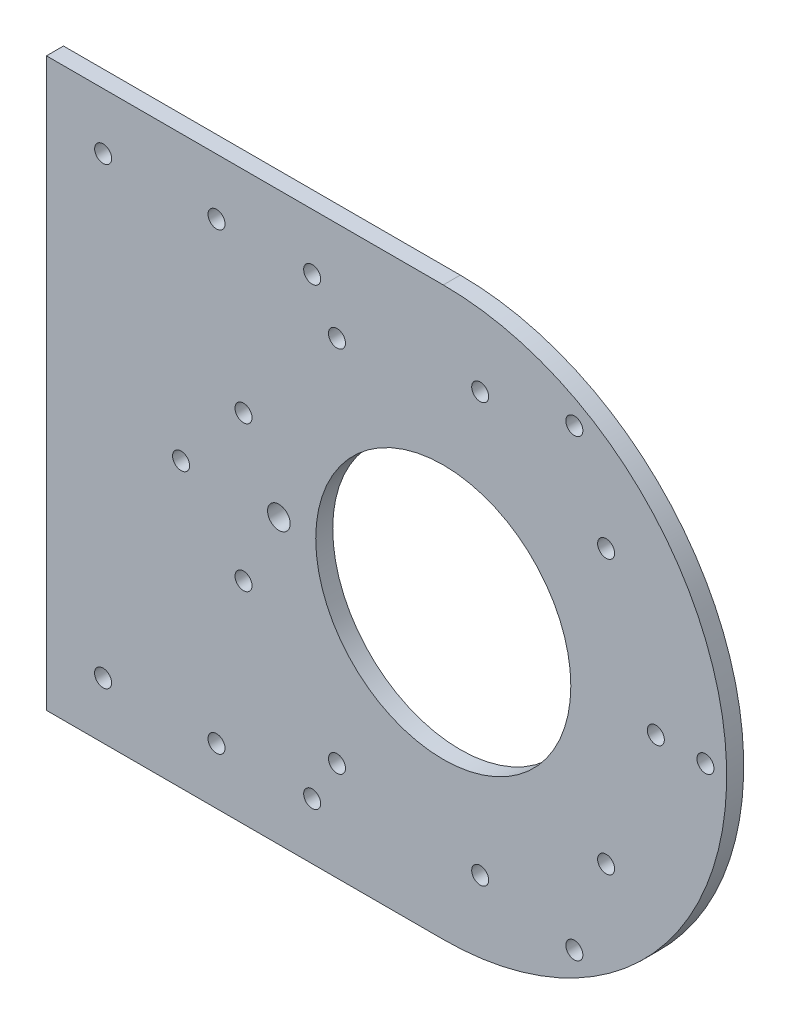
from build123d import *

# Parameters (mm, degrees)
SKETCH_1_R          = 1.5
SKETCH_1_R_2        = 22.5
EXTRUDE_1_DEPTH     = 3
SKETCH_2_R          = 2
SKETCH_2_R_2        = 1.75
CUT_EXTRUDE_1_DEPTH = 10
SKETCH_3_R          = 1.5
SKETCH_3_R_2        = 1.75
SKETCH_3_R_3        = 22.5
CUT_EXTRUDE_2_DEPTH = 10
SKETCH_4_R          = 1.5
CUT_EXTRUDE_3_DEPTH = 10
SKETCH_5_R          = 1.5
CUT_EXTRUDE_4_DEPTH = 95.387499172


with BuildPart() as part:
    # 草图1 → 凸台-拉伸1 (new body)
    with BuildSketch(Plane.XY):
        with BuildLine():
            Line((-10, 50), (-350, 50))
            ThreePointArc((-350, 50), (-400, 0), (-350, -50))
            Line((-350, -50), (-10, -50))
            ThreePointArc((-10, -50), (40, 0), (-10, 50))
        make_face()
        with Locations((-387.5, 0)):
            Circle(SKETCH_1_R, mode=Mode.SUBTRACT)
        with Locations((-378.726666617, 24.104535363)):
            Circle(SKETCH_1_R, mode=Mode.SUBTRACT)
        with Locations((-356.511806663, 36.930290738)):
            Circle(SKETCH_1_R, mode=Mode.SUBTRACT)
        with Locations((-331.25, 32.475952642)):
            Circle(SKETCH_1_R, mode=Mode.SUBTRACT)
        with Locations((-314.761526721, 12.825755375)):
            Circle(SKETCH_1_R, mode=Mode.SUBTRACT)
        with Locations((-314.761526721, -12.825755375)):
            Circle(SKETCH_1_R, mode=Mode.SUBTRACT)
        with Locations((-331.25, -32.475952642)):
            Circle(SKETCH_1_R, mode=Mode.SUBTRACT)
        with Locations((-356.511806663, -36.930290738)):
            Circle(SKETCH_1_R, mode=Mode.SUBTRACT)
        with Locations((-378.726666617, -24.104535363)):
            Circle(SKETCH_1_R, mode=Mode.SUBTRACT)
        with Locations((-350, 0)):
            Circle(SKETCH_1_R_2, mode=Mode.SUBTRACT)
        with Locations((-10, 0)):
            Circle(SKETCH_1_R_2, mode=Mode.SUBTRACT)
        with Locations((18.726666617, -24.104535363)):
            Circle(SKETCH_1_R, mode=Mode.SUBTRACT)
        with Locations((-3.488193337, -36.930290738)):
            Circle(SKETCH_1_R, mode=Mode.SUBTRACT)
        with Locations((-28.75, -32.475952642)):
            Circle(SKETCH_1_R, mode=Mode.SUBTRACT)
        with Locations((-45.238473279, -12.825755375)):
            Circle(SKETCH_1_R, mode=Mode.SUBTRACT)
        with Locations((-45.238473279, 12.825755375)):
            Circle(SKETCH_1_R, mode=Mode.SUBTRACT)
        with Locations((-28.75, 32.475952642)):
            Circle(SKETCH_1_R, mode=Mode.SUBTRACT)
        with Locations((-3.488193337, 36.930290738)):
            Circle(SKETCH_1_R, mode=Mode.SUBTRACT)
        with Locations((18.726666617, 24.104535363)):
            Circle(SKETCH_1_R, mode=Mode.SUBTRACT)
        with Locations((27.5, 0)):
            Circle(SKETCH_1_R, mode=Mode.SUBTRACT)
    extrude(amount=EXTRUDE_1_DEPTH)

    # 草图2 → 切除-拉伸1 (cut)
    with BuildSketch(Plane(origin=(0, 0, 0), x_dir=(-1, 0, 0), z_dir=(0, 0, -1))):
        with Locations((39, 0)):
            Circle(SKETCH_2_R)
        with Locations(Location((321, 0, 0), (0, 0, 180))):
            Circle(SKETCH_2_R_2)
    extrude(amount=-CUT_EXTRUDE_1_DEPTH, mode=Mode.SUBTRACT)

    # 草图3 → 切除-拉伸2 (cut)
    with BuildSketch(Plane(origin=(0, 0, 0), x_dir=(-1, 0, 0), z_dir=(0, 0, -1))):
        with BuildLine():
            Line((80, -50), (180, -50))
            Line((180, -50), (350, -50))
            ThreePointArc((350, -50), (400, 0), (350, 50))
            Line((350, 50), (80, 50))
            Line((80, 50), (80, -50))
        make_face()
        with Locations((331.25, -32.475952642)):
            Circle(SKETCH_3_R, mode=Mode.SUBTRACT)
        with Locations((356.511806663, -36.930290738)):
            Circle(SKETCH_3_R, mode=Mode.SUBTRACT)
        with Locations((378.726666617, -24.104535363)):
            Circle(SKETCH_3_R, mode=Mode.SUBTRACT)
        with Locations((314.761526721, -12.825755375)):
            Circle(SKETCH_3_R, mode=Mode.SUBTRACT)
        with Locations((321, 0)):
            Circle(SKETCH_3_R_2, mode=Mode.SUBTRACT)
        with Locations((314.761526721, 12.825755375)):
            Circle(SKETCH_3_R, mode=Mode.SUBTRACT)
        with Locations((350, 0)):
            Circle(SKETCH_3_R_3, mode=Mode.SUBTRACT)
        with Locations((387.5, 0)):
            Circle(SKETCH_3_R, mode=Mode.SUBTRACT)
        with Locations((331.25, 32.475952642)):
            Circle(SKETCH_3_R, mode=Mode.SUBTRACT)
        with Locations((378.726666617, 24.104535363)):
            Circle(SKETCH_3_R, mode=Mode.SUBTRACT)
        with Locations((356.511806663, 36.930290738)):
            Circle(SKETCH_3_R, mode=Mode.SUBTRACT)
    extrude(amount=-CUT_EXTRUDE_2_DEPTH, mode=Mode.SUBTRACT)

    # 草图4 → 切除-拉伸3 (cut)
    with BuildSketch(Plane(origin=(0, 0, 0), x_dir=(-1, 0, 0), z_dir=(0, 0, -1))):
        with Locations((-36.25, 0)):
            Circle(SKETCH_4_R)
        with Locations((-13.125, 40.053674925)):
            Circle(SKETCH_4_R)
        with Locations((33.125, 40.053674925)):
            Circle(SKETCH_4_R)
        with Locations((56.25, 0)):
            Circle(SKETCH_4_R)
        with Locations((33.125, -40.053674925)):
            Circle(SKETCH_4_R)
        with Locations((-13.125, -40.053674925)):
            Circle(SKETCH_4_R)
    extrude(amount=-CUT_EXTRUDE_3_DEPTH, mode=Mode.SUBTRACT)

    # 草图5 → 切除-拉伸4 (cut, through all)
    with BuildSketch(Plane.XY.offset(3)):
        with Locations((-70, 40.051993223)):
            Circle(SKETCH_5_R)
        with Locations((-50, 40.051993223)):
            Circle(SKETCH_5_R)
        with Locations((-70.013968461, -40.048849195)):
            Circle(SKETCH_5_R)
        with Locations((-50, -40.048849193)):
            Circle(SKETCH_5_R)
    extrude(amount=-CUT_EXTRUDE_4_DEPTH, mode=Mode.SUBTRACT)


solid = part.part
